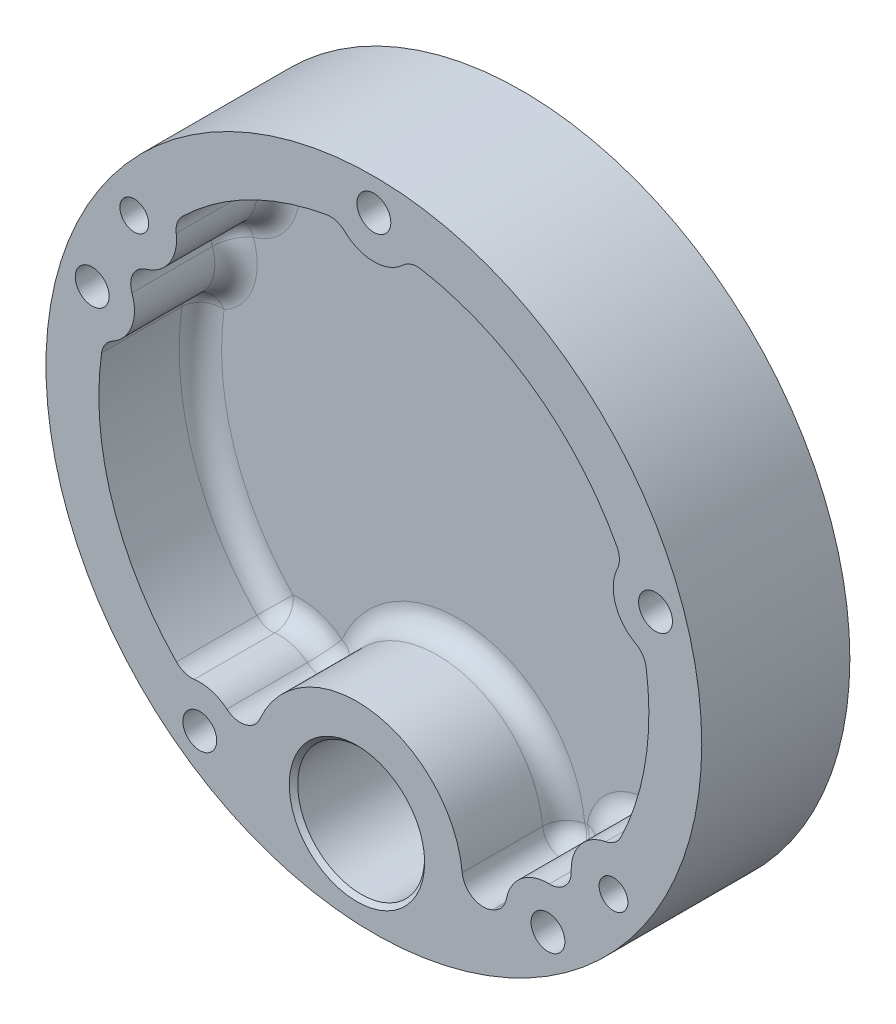
from build123d import *

# Parameters (mm, degrees)
SKETCH_1_R                = 77.5
EXTRUDE_1_DEPTH           = 35
SKETCH_2_R                = 15
CUT_EXTRUDE_1_DEPTH       = 116.05433499
CHAMFER_1_SIZE            = 1
HOLE_WIZARD_1_D           = 8
HOLE_WIZARD_1_CBORE_D     = 14
HOLE_WIZARD_1_CBORE_DEPTH = 9
PATTERN_CIRCULAR_1_COUNT  = 5
HOLE_WIZARD_M8_1_D        = 6.8
CUT_EXTRUDE_2_DEPTH       = 24
FILLET_1_R                = 5


with BuildPart() as part:
    # 草图1 → 凸台-拉伸1 (new body)
    with BuildSketch(Plane.XY):
        Circle(SKETCH_1_R)
    extrude(amount=EXTRUDE_1_DEPTH)

    # 草图2 → 切除-拉伸1 (cut, through all)
    with BuildSketch(Plane.XY.offset(35)):
        with Locations((-4, -57)):
            Circle(SKETCH_2_R)
    extrude(amount=-CUT_EXTRUDE_1_DEPTH, mode=Mode.SUBTRACT)

    # 倒角1
    chamfer_1_edges = [part.edges().sort_by_distance(p)[0] for p in [
        (-19, -57, 0),
        (-19, -57, 35),
    ]]
    chamfer(chamfer_1_edges, length=CHAMFER_1_SIZE)

    # 孔1 (through all)
    with Locations(Plane(origin=(0, 0, 0), x_dir=(1, 0, 0), z_dir=(0, 0, -1))):
        with Locations((0, -70)):
            hole_wizard_1 = CounterBoreHole(HOLE_WIZARD_1_D / 2, HOLE_WIZARD_1_CBORE_D / 2, HOLE_WIZARD_1_CBORE_DEPTH)

    # 阵列(圆周)1: 孔1 ×5 about axis
    pattern_circular_1_axis = Axis((0, 0, 0), (0, 0, 1))
    for i in range(1, PATTERN_CIRCULAR_1_COUNT):
        add(hole_wizard_1.rotate(pattern_circular_1_axis, i * 360 / PATTERN_CIRCULAR_1_COUNT), mode=Mode.SUBTRACT)

    # M8 螺纹孔1 (through all)
    with Locations(Plane.XY.offset(35)):
        with Locations((-56.631189606, 41.14496766), (56.631189606, -41.14496766)):
            Hole(HOLE_WIZARD_M8_1_D / 2)

    # 草图7 → 切除-拉伸2 (cut)
    with BuildSketch(Plane.XY.offset(35)):
        with BuildLine():
            ThreePointArc((57.446485936, 30.412189227), (38.206041399, 52.586104634), (11.171770317, 64.032738095))
            ThreePointArc((11.171770317, 64.032738095), (8.869948511, 63.894555935), (6.87493558, 62.738095238))
            ThreePointArc((6.87493558, 62.738095238), (0, 60), (-6.87493558, 62.738095238))
            ThreePointArc((-6.87493558, 62.738095238), (-8.869948511, 63.894555935), (-11.171770317, 64.032738095))
            ThreePointArc((-11.171770317, 64.032738095), (-29.509382483, 57.915424072), (-45.236971481, 46.67565116))
            ThreePointArc((-45.236971481, 46.67565116), (-46.478156676, 44.732216765), (-46.715199498, 42.438466857))
            ThreePointArc((-46.715199498, 42.438466857), (-48.266255482, 35.665197857), (-53.856148227, 31.537723241))
            ThreePointArc((-53.856148227, 31.537723241), (-56.923660159, 29.004053529), (-57.170403739, 25.033130556))
            ThreePointArc((-57.170403739, 25.033130556), (-57.22394433, 18.084743619), (-61.791946226, 12.848685341))
            ThreePointArc((-61.791946226, 12.848685341), (-63.508298607, 11.308681301), (-64.351019707, 9.162219309))
            ThreePointArc((-64.351019707, 9.162219309), (-61.818673559, -20.086104634), (-46.67565116, -45.236971481))
            ThreePointArc((-46.67565116, -45.236971481), (-44.732216765, -46.478156676), (-42.438466857, -46.715199498))
            ThreePointArc((-42.438466857, -46.715199498), (-38.357298199, -47.027601789), (-34.743162658, -48.948944315))
            ThreePointArc((-34.743162658, -48.948944315), (-30.381779111, -49.971285841), (-26.951883464, -47.089851391))
            ThreePointArc((-26.951883464, -47.089851391), (-0.114506142, -32.303786981), (20.88609771, -54.616275863))
            ThreePointArc((20.88609771, -54.616275863), (23.401425614, -58.491437463), (28.01859369, -58.651158622))
            ThreePointArc((28.01859369, -58.651158622), (28.309318995, -58.511387422), (28.599347072, -58.37017515))
            ThreePointArc((28.599347072, -58.37017515), (30.380338596, -56.905406523), (31.314587418, -54.797170987))
            ThreePointArc((31.314587418, -54.797170987), (34.882784548, -48.834712026), (41.474548269, -46.636622251))
            ThreePointArc((41.474548269, -46.636622251), (45.174872479, -45.174872479), (46.636622251, -41.474548269))
            ThreePointArc((46.636622251, -41.474548269), (48.834712026, -34.882784548), (54.797170987, -31.314587418))
            ThreePointArc((54.797170987, -31.314587418), (56.905406523, -30.380338596), (58.37017515, -28.599347072))
            ThreePointArc((58.37017515, -28.599347072), (64.199742139, -10.168240228), (64.351019707, 9.162219309))
            ThreePointArc((64.351019707, 9.162219309), (63.508298607, 11.308681301), (61.791946226, 12.848685341))
            ThreePointArc((61.791946226, 12.848685341), (57.063390978, 18.541019662), (57.543002367, 25.925589906))
            ThreePointArc((57.543002367, 25.925589906), (58.026368949, 28.180325963), (57.446485936, 30.412189227))
        make_face()
    extrude(amount=-CUT_EXTRUDE_2_DEPTH, mode=Mode.SUBTRACT)

    # 圆角1
    fillet_1_edges = [part.edges().sort_by_distance(p)[0] for p in [
        (23.401425614, -58.491437463, 11),
        (-0.114506142, -32.303786981, 11),
        (-30.381779111, -49.971285841, 11),
        (-38.357298199, -47.027601789, 11),
        (-44.732216765, -46.478156676, 11),
        (-61.818673559, -20.086104634, 11),
        (-63.508298607, 11.308681301, 11),
        (-57.22394433, 18.084743619, 11),
        (-56.923660159, 29.004053529, 11),
        (-48.266255482, 35.665197857, 11),
        (-46.478156676, 44.732216765, 11),
        (-29.509382483, 57.915424072, 11),
        (-8.869948511, 63.894555935, 11),
        (0, 60, 11),
        (8.869948511, 63.894555935, 11),
        (38.206041399, 52.586104634, 11),
        (58.026368949, 28.180325963, 11),
        (57.063390978, 18.541019662, 11),
        (63.508298607, 11.308681301, 11),
        (64.199742139, -10.168240228, 11),
        (56.905406523, -30.380338596, 11),
        (48.834712026, -34.882784548, 11),
        (45.174872479, -45.174872479, 11),
        (34.882784548, -48.834712026, 11),
        (30.380338596, -56.905406523, 11),
        (28.309318995, -58.511387422, 11),
    ]]
    fillet(fillet_1_edges, radius=FILLET_1_R)


solid = part.part
